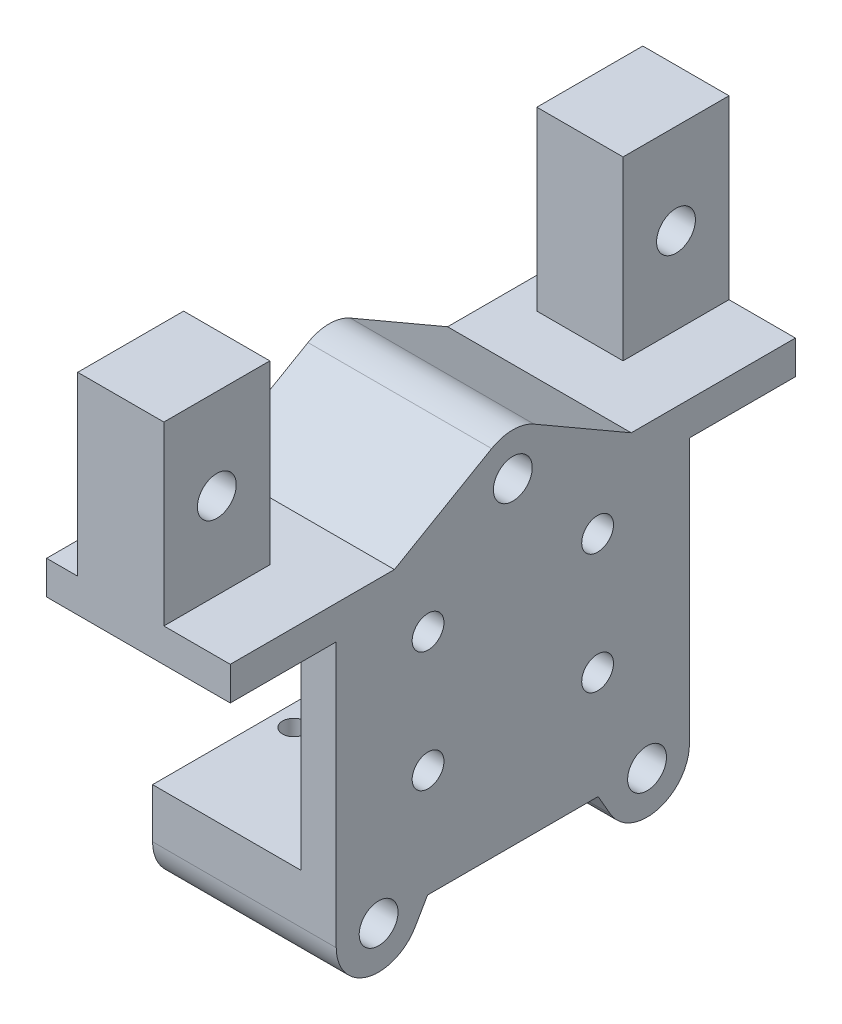
from build123d import *

# Parameters (mm, degrees)
BOSS_EXTRUDE1_DEPTH            = 50
F_3_2_3_2_DIAMETER_HOLE1_D     = 3.2
F_3_2_3_2_DIAMETER_HOLE1_DEPTH = 7
SKETCH5_R                      = 2.25
CUT_EXTRUDE1_DEPTH             = 71.434810286
SKETCH6_W                      = 15
SKETCH6_H                      = 4.75
BOSS_EXTRUDE2_DEPTH            = 26
SKETCH8_W                      = 12.2
SKETCH8_H                      = 15
BOSS_EXTRUDE3_DEPTH            = 25
SKETCH9_R                      = 2.75
CUT_EXTRUDE2_DEPTH             = 96.990220856
BOSS_EXTRUDE4_DEPTH            = 26
CUT_EXTRUDE3_REACH             = 99.075
SKETCH11_R                     = 2.75


with BuildPart() as part:
    # Sketch1 → Boss-Extrude1 (new body)
    with BuildSketch(Plane.XY):
        Polygon((-10.5, 0), (15.5, 0), (15.5, 42.25), (-10.5, 42.25), (-10.5, 37.5), (10.5, 37.5), (10.5, 7), (-10.5, 7), align=None)
    extrude(amount=BOSS_EXTRUDE1_DEPTH)

    # Ø3.2 (3.2) Diameter Hole1
    with Locations(Plane(origin=(0, 0, 0), x_dir=(-1, 0, 0), z_dir=(0, -1, 0))):
        with Locations((-7.5, -17), (7.5, -17), (7.5, -33), (-7.5, -33)):
            Hole(F_3_2_3_2_DIAMETER_HOLE1_D / 2, depth=F_3_2_3_2_DIAMETER_HOLE1_DEPTH)

    # Sketch5 → Cut-Extrude1 (cut, through all)
    with BuildSketch(Plane(origin=(15.5, 0, 0), x_dir=(0, 0, -1), z_dir=(1, 0, 0))):
        with Locations(Location((-37, 32.25, 0), (0, 0, 90))):
            Circle(SKETCH5_R)
        with Locations(Location((-13, 32.25, 0), (0, 0, 90))):
            Circle(SKETCH5_R)
        with Locations(Location((-37, 15.25, 0), (0, 0, 90))):
            Circle(SKETCH5_R)
        with Locations(Location((-13, 15.25, 0), (0, 0, 90))):
            Circle(SKETCH5_R)
    extrude(amount=-CUT_EXTRUDE1_DEPTH, mode=Mode.SUBTRACT)

    # Sketch6 → Boss-Extrude2 (add)
    with BuildSketch(Plane(origin=(15.5, 0, 0), x_dir=(0, 0, -1), z_dir=(1, 0, 0))):
        with Locations((-57.5, 39.875)):
            Rectangle(SKETCH6_W, SKETCH6_H)
        with Locations((7.5, 39.875)):
            Rectangle(SKETCH6_W, SKETCH6_H)
    extrude(amount=-BOSS_EXTRUDE2_DEPTH)

    # Sketch8 → Boss-Extrude3 (add)
    with BuildSketch(Plane(origin=(0, 42.25, 0), x_dir=(1, 0, 0), z_dir=(0, 1, 0))):
        with Locations((0, 7.5)):
            Rectangle(SKETCH8_W, SKETCH8_H)
        with Locations((0, -57.5)):
            Rectangle(SKETCH8_W, SKETCH8_H)
    extrude(amount=BOSS_EXTRUDE3_DEPTH)

    # Sketch9 → Cut-Extrude2 (cut, through all)
    with BuildSketch(Plane.ZY.offset(6.1)):
        with Locations((-7.5, 54.45)):
            Circle(SKETCH9_R)
        with Locations((57.5, 54.45)):
            Circle(SKETCH9_R)
    extrude(amount=-CUT_EXTRUDE2_DEPTH, mode=Mode.SUBTRACT)

    # Sketch10 → Boss-Extrude4 (add)
    with BuildSketch(Plane.ZY.offset(10.5)):
        with BuildLine():
            Line((11.196152423, -3), (12.92820323, 0))
            Line((12.92820323, 0), (0, 0))
            ThreePointArc((0, 0), (4.447085729, -5.795554958), (11.196152423, -3))
        make_face()
        with BuildLine():
            Line((22, 50.196152423), (8.236860279, 42.25))
            Line((8.236860279, 42.25), (41.763139721, 42.25))
            Line((41.763139721, 42.25), (28, 50.196152423))
            ThreePointArc((28, 50.196152423), (25, 51), (22, 50.196152423))
        make_face()
        with BuildLine():
            Line((38.803847577, -3), (37.07179677, 0))
            Line((37.07179677, 0), (50, 0))
            ThreePointArc((50, 0), (45.552914271, -5.795554958), (38.803847577, -3))
        make_face()
    extrude(amount=-BOSS_EXTRUDE4_DEPTH)

    # Sketch11 → Cut-Extrude3 (cut, up to next)
    with BuildSketch(Plane.ZY.offset(10.5), mode=Mode.PRIVATE) as cut_extrude3_sk1:
        with Locations(Location((25, 45, 0), (0, 0, 270))):
            Circle(SKETCH11_R)
    cut_extrude3_tool1 = extrude(cut_extrude3_sk1.sketch, amount=-CUT_EXTRUDE3_REACH, mode=Mode.PRIVATE) & part.part
    # Sketch11 → Cut-Extrude3 (cut, up to next)
    with BuildSketch(Plane.ZY.offset(10.5), mode=Mode.PRIVATE) as cut_extrude3_sk2:
        with Locations(Location((44, 0, 0), (0, 0, 270))):
            Circle(SKETCH11_R)
    cut_extrude3_tool2 = extrude(cut_extrude3_sk2.sketch, amount=-CUT_EXTRUDE3_REACH, mode=Mode.PRIVATE) & part.part
    # Sketch11 → Cut-Extrude3 (cut, up to next)
    with BuildSketch(Plane.ZY.offset(10.5), mode=Mode.PRIVATE) as cut_extrude3_sk3:
        with Locations(Location((6, 0, 0), (0, 0, 270))):
            Circle(SKETCH11_R)
    cut_extrude3_tool3 = extrude(cut_extrude3_sk3.sketch, amount=-CUT_EXTRUDE3_REACH, mode=Mode.PRIVATE) & part.part
    add(cut_extrude3_tool1.solids().sort_by_distance((-10.5, 45, 25))[0], mode=Mode.SUBTRACT)
    add(cut_extrude3_tool2.solids().sort_by_distance((-10.5, 0, 44))[0], mode=Mode.SUBTRACT)
    add(cut_extrude3_tool3.solids().sort_by_distance((-10.5, 0, 6))[0], mode=Mode.SUBTRACT)


solid = part.part
